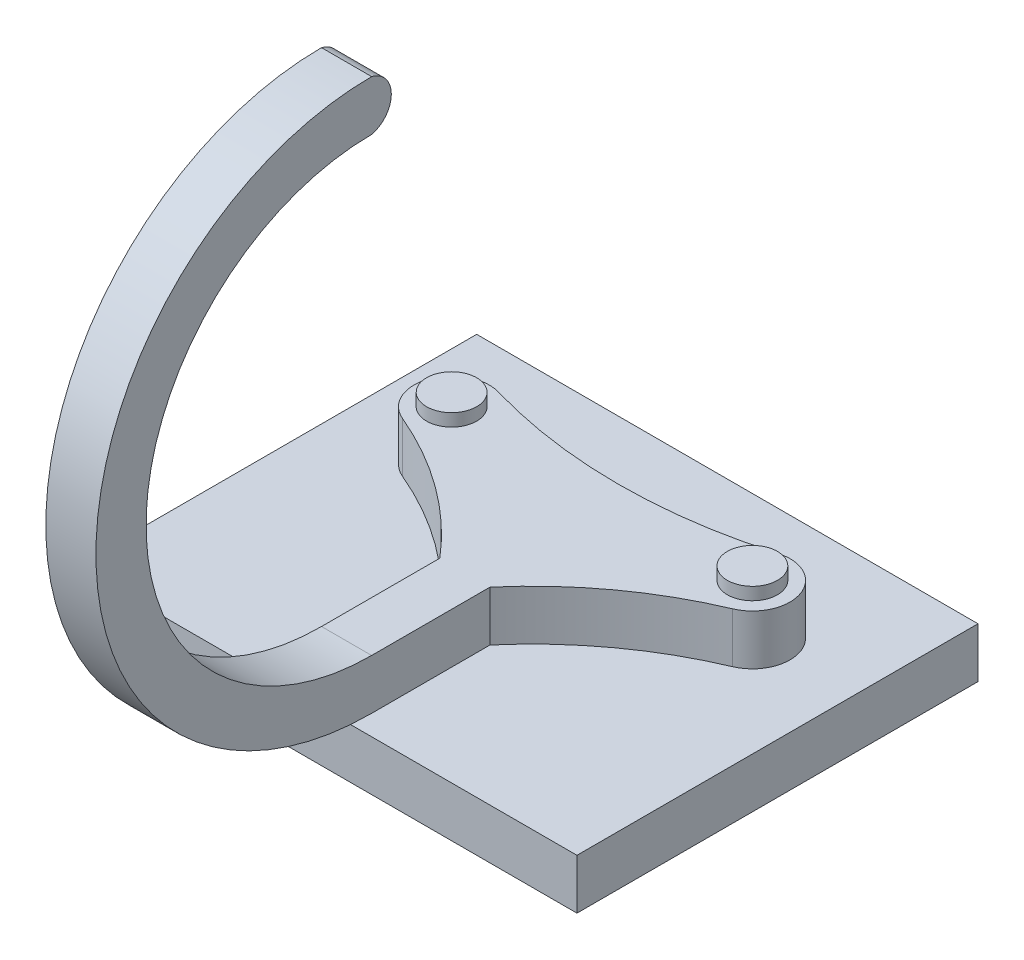
from build123d import *

# Parameters (mm, degrees)
SKETCH1_W           = 20
SKETCH1_H           = 16
BOSS_EXTRUDE1_DEPTH = 2
SKETCH2_R           = 1
BOSS_EXTRUDE2_DEPTH = 2
BOSS_EXTRUDE3_DEPTH = 1
SKETCH10_R          = 1
BOSS_EXTRUDE4_DEPTH = 2.5


with BuildPart() as part:
    # Sketch1 → Boss-Extrude1 (new body)
    with BuildSketch(Plane(origin=(0, 0, 0), x_dir=(1, 0, 0), z_dir=(0, 1, 0))):
        Rectangle(SKETCH1_W, SKETCH1_H)
    extrude(amount=BOSS_EXTRUDE1_DEPTH)

    # Sketch2 → Boss-Extrude2 (add)
    with BuildSketch(Plane(origin=(0, 2, 0), x_dir=(1, 0, 0), z_dir=(0, 1, 0))):
        with BuildLine():
            Line((-1, -2.469823306), (-1, -7.190883186))
            Line((-1, -7.190883186), (1, -7.190883186))
            Line((1, -7.190883186), (1, -2.469823306))
            ThreePointArc((1, -2.469823306), (3.552605477, -0.099588475), (6.583085105, 1.617968249))
            ThreePointArc((6.583085105, 1.617968249), (7.413613283, 3.501694616), (5.581395349, 4.440406243))
            ThreePointArc((5.581395349, 4.440406243), (0, 3.645822822), (-5.581395349, 4.440406243))
            ThreePointArc((-5.581395349, 4.440406243), (-7.413613283, 3.501694616), (-6.583085105, 1.617968249))
            ThreePointArc((-6.583085105, 1.617968249), (-3.552605477, -0.099588475), (-1, -2.469823306))
        make_face()
        with Locations(Location((-6, 3, 0), (0, 0, 270))):
            Circle(SKETCH2_R, mode=Mode.SUBTRACT)
        with Locations(Location((6, 3, 0), (0, 0, 270))):
            Circle(SKETCH2_R, mode=Mode.SUBTRACT)
    extrude(amount=BOSS_EXTRUDE2_DEPTH)

    # Sketch8 → Boss-Extrude3 (add, symmetric)
    with BuildSketch(Plane(origin=(0, 0, 0), x_dir=(0, 0, -1), z_dir=(1, 0, 0))):
        with BuildLine():
            Line((-7.190883186, 4), (-7.190883186, 2))
            ThreePointArc((-7.190883186, 2), (-18.190883186, 13), (-7.190883186, 24))
            ThreePointArc((-7.190883186, 24), (-6.40597694, 23), (-7.190883186, 22))
            ThreePointArc((-7.190883186, 22), (-16.190883186, 13), (-7.190883186, 4))
        make_face()
    extrude(amount=BOSS_EXTRUDE3_DEPTH, both=True)

    # Sketch10 → Boss-Extrude4 (add)
    with BuildSketch(Plane(origin=(0, 2, 0), x_dir=(1, 0, 0), z_dir=(0, 1, 0))):
        with Locations(Location((6, 3, 0), (0, 0, 270))):
            Circle(SKETCH10_R)
        with Locations(Location((-6, 3, 0), (0, 0, 270))):
            Circle(SKETCH10_R)
    extrude(amount=BOSS_EXTRUDE4_DEPTH)


solid = part.part
